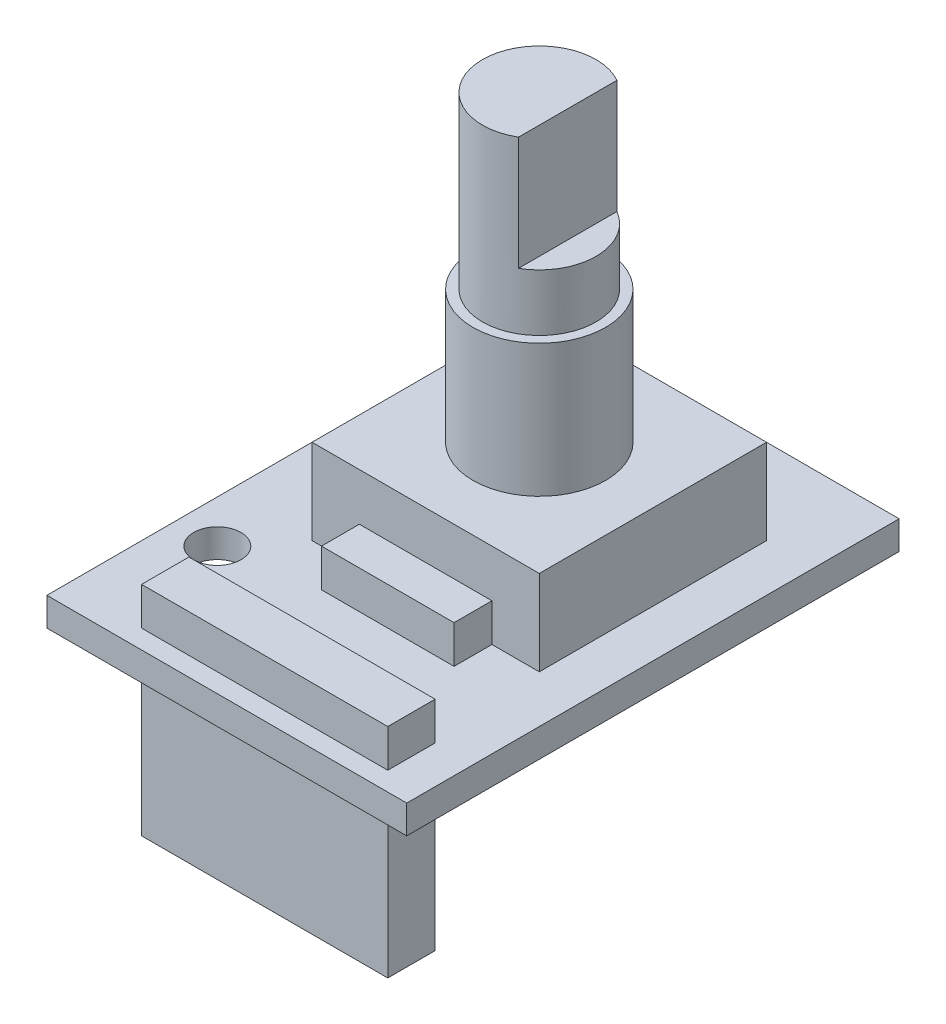
from build123d import *

# Parameters (mm, degrees)
SCHIZZO1_W                        = 19
SCHIZZO1_H                        = 26
ESTRUSIONE_ESTRUSIONE1_DEPTH      = 1.5
SCHIZZO2_W                        = 12
SCHIZZO2_H                        = 12
ESTRUSIONE_ESTRUSIONE2_DEPTH      = 4.5
SCHIZZO4_R                        = 3.5
ESTRUSIONE_ESTRUSIONE3_DEPTH      = 7
SCHIZZO5_R                        = 3
ESTRUSIONE_ESTRUSIONE4_DEPTH      = 9
TAGLIO_ESTRUSIONE1_DEPTH          = 6
SCHIZZO7_R                        = 1.25
TAGLIO_ESTRUSIONE2_DEPTH          = 6
ESTRUSIONE_ESTRUSIONE5_DEPTH      = 2
ESTRUSIONE_ESTRUSIONE5_DEPTH_BACK = 9.5
SCHIZZO8_W                        = 13
SCHIZZO8_H                        = 2.5
SCHIZZO9_W                        = 9.25
SCHIZZO9_H                        = 18.5
ESTRUSIONE_ESTRUSIONE6_DEPTH      = 1.5
SCHIZZO10_W                       = 7
SCHIZZO10_H                       = 2
ESTRUSIONE_ESTRUSIONE7_DEPTH      = 2


with BuildPart() as part:
    # Schizzo1 → Estrusione-Estrusione1 (new body)
    with BuildSketch(Plane(origin=(0, 0, 0), x_dir=(1, 0, 0), z_dir=(0, 1, 0))):
        Rectangle(SCHIZZO1_W, SCHIZZO1_H)
    extrude(amount=ESTRUSIONE_ESTRUSIONE1_DEPTH)

    # Schizzo2 → Estrusione-Estrusione2 (add)
    with BuildSketch(Plane(origin=(0, 1.5, 0), x_dir=(1, 0, 0), z_dir=(0, 1, 0))):
        with Locations((1, 2.5)):
            Rectangle(SCHIZZO2_W, SCHIZZO2_H)
    extrude(amount=ESTRUSIONE_ESTRUSIONE2_DEPTH)

    # Schizzo4 → Estrusione-Estrusione3 (add)
    with BuildSketch(Plane(origin=(0, 6, 0), x_dir=(1, 0, 0), z_dir=(0, 1, 0))):
        with Locations(Location((1, 2.5, 0), (0, 0, 270))):
            Circle(SCHIZZO4_R)
    extrude(amount=ESTRUSIONE_ESTRUSIONE3_DEPTH)

    # Schizzo5 → Estrusione-Estrusione4 (add)
    with BuildSketch(Plane(origin=(0, 13, 0), x_dir=(1, 0, 0), z_dir=(0, 1, 0))):
        with Locations(Location((1, 2.5, 0), (0, 0, 270))):
            Circle(SCHIZZO5_R)
    extrude(amount=ESTRUSIONE_ESTRUSIONE4_DEPTH)

    # Schizzo6 → Taglio-Estrusione1 (cut)
    with BuildSketch(Plane(origin=(0, 22, 0), x_dir=(1, 0, 0), z_dir=(0, 1, 0))):
        Polygon((2.5, 58.528036495), (2.5, 5.098076211), (2.5, -0.098076211), (2.5, -53.528036495), (109.359920567, -53.528036495), (109.359920567, 58.528036495), align=None)
    extrude(amount=-TAGLIO_ESTRUSIONE1_DEPTH, mode=Mode.SUBTRACT)

    # Schizzo7 → Taglio-Estrusione2 (cut)
    with BuildSketch(Plane(origin=(0, 1.5, 0), x_dir=(1, 0, 0), z_dir=(0, 1, 0))):
        with Locations(Location((-7.25, 7.75, 0), (0, 0, 270))):
            Circle(SCHIZZO7_R)
        with Locations(Location((-7.25, -6.25, 0), (0, 0, 270))):
            Circle(SCHIZZO7_R)
    extrude(amount=-TAGLIO_ESTRUSIONE2_DEPTH, mode=Mode.SUBTRACT)

    # Schizzo8 → Estrusione-Estrusione5 (add, two sides: drawn at the far end of the back side and taken through both)
    with BuildSketch(Plane(origin=(0, 1.5, 0), x_dir=(1, 0, 0), z_dir=(0, 1, 0)).offset(-ESTRUSIONE_ESTRUSIONE5_DEPTH_BACK)):
        with Locations((1, -10.75)):
            Rectangle(SCHIZZO8_W, SCHIZZO8_H)
    extrude(amount=ESTRUSIONE_ESTRUSIONE5_DEPTH + ESTRUSIONE_ESTRUSIONE5_DEPTH_BACK)

    # Schizzo9 → Estrusione-Estrusione6 (add)
    with BuildSketch(Plane.XZ):
        with Locations((1.875, -2.75)):
            Rectangle(SCHIZZO9_W, SCHIZZO9_H)
    extrude(amount=ESTRUSIONE_ESTRUSIONE6_DEPTH)

    # Schizzo10 → Estrusione-Estrusione7 (add)
    with BuildSketch(Plane(origin=(0, 1.5, 0), x_dir=(1, 0, 0), z_dir=(0, 1, 0))):
        with Locations((1, 9.5)):
            Rectangle(SCHIZZO10_W, SCHIZZO10_H)
        with Locations((1, -4.5)):
            Rectangle(SCHIZZO10_W, SCHIZZO10_H)
    extrude(amount=ESTRUSIONE_ESTRUSIONE7_DEPTH)


solid = part.part
